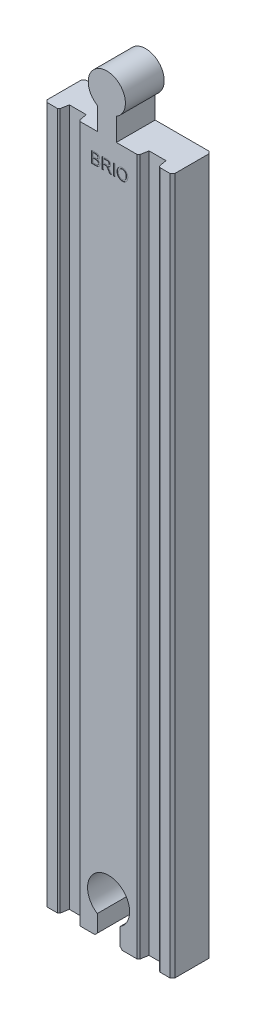
from build123d import *

# Parameters (mm, degrees)
BOSS_EXTRUDE1_DEPTH        = 215.5
BOSS_EXTRUDE2_DEPTH        = 12
BOSS_EXTRUDE2_2_DEPTH      = 12
CHAMFER1_SIZE              = 0.75
BOSS_EXTRUDE4_DEPTH        = 0.1
BOSS_EXTRUDE4_DEPTH_BACK   = 0.1
BOSS_EXTRUDE4_2_DEPTH      = 0.1
BOSS_EXTRUDE4_2_DEPTH_BACK = 0.1
BOSS_EXTRUDE4_3_DEPTH      = 0.1
BOSS_EXTRUDE4_3_DEPTH_BACK = 0.1
SKETCH6_W                  = 0.493589743
SKETCH6_H                  = 3.5
BOSS_EXTRUDE4_4_DEPTH      = 0.1
BOSS_EXTRUDE4_4_DEPTH_BACK = 0.1


with BuildPart() as part:
    # Sketch2 → Boss-Extrude1 (new body)
    with BuildSketch(Plane(origin=(0, 0, 0), x_dir=(1, 0, 0), z_dir=(0, 1, 0))):
        Polygon((0.75, 0), (3.906284454, 0), (4.375743725, 0.393923101), (4.8, 2.8), (10.05, 2.8), (10.474256275, 0.393923101), (10.943715546, 0), (28.556284454, 0), (29.025743725, 0.393923101), (29.45, 2.8), (34.7, 2.8), (35.124256275, 0.393923101), (35.593715546, 0), (38.75, 0), (39.5, 0.75), (39.5, 11.25), (38.75, 12), (0.75, 12), (0, 11.25), (0, 0.75), align=None)
    extrude(amount=BOSS_EXTRUDE1_DEPTH)


with BuildPart() as body_2:
    # Sketch3 → Boss-Extrude2 (new body)
    with BuildSketch(Plane.XY):
        with BuildLine():
            Line((16.25, 215.5), (16.25, 222.5))
            ThreePointArc((16.25, 222.5), (19.2, 233.185585072), (22.15, 222.5))
            Line((22.15, 222.5), (22.15, 215.5))
            Line((22.15, 215.5), (16.25, 215.5))
        make_face()
    extrude(amount=-BOSS_EXTRUDE2_DEPTH)

    # Combine1: union part
    add(part.part)


with BuildPart() as body_3:
    # Sketch3 → Boss-Extrude2 2 (new body)
    with BuildSketch(Plane.XY):
        with BuildLine():
            Line((23.25, 0), (23.25, 6.022774425))
            ThreePointArc((23.25, 6.022774425), (19.75, 18), (16.25, 6.022774425))
            Line((16.25, 6.022774425), (16.25, 0))
            Line((16.25, 0), (16.25, -11.021514521))
            Line((16.25, -11.021514521), (23.25, -11.021514521))
            Line((23.25, -11.021514521), (23.25, 0))
        make_face()
    extrude(amount=-BOSS_EXTRUDE2_2_DEPTH)


with BuildPart() as body_2_1:
    add(body_2.part)

    # Combine2: cut body 3
    add(body_3.part, mode=Mode.SUBTRACT)

    # Chamfer1
    chamfer1_edges = [body_2_1.edges().sort_by_distance(p)[0] for p in [
        (23.25, 0, -6),
        (16.25, 0, -6),
    ]]
    chamfer(chamfer1_edges, length=CHAMFER1_SIZE)


with BuildPart() as body_2_2:
    # Sketch6 → Boss-Extrude4 (new, two sides: drawn at the far end of the back side and taken through both)
    with BuildSketch(Plane.XY.offset(-BOSS_EXTRUDE4_DEPTH_BACK)):
        with BuildLine():
            Line((14.469436437, 206.106414383), (14.469436437, 209.606414383))
            Line((14.469436437, 209.606414383), (15.779833072, 209.606414383))
            add(Edge.make_bspline(
                [(15.779833072, 209.606414383), (15.812328741, 209.606289722), (15.87573703, 209.606046472), (15.968326243, 209.599963054), (16.056015141, 209.5916422), (16.1389925, 209.580916364), (16.216899275, 209.565353394), (16.289662868, 209.546499896), (16.357661938, 209.524752995), (16.440780438, 209.491625421), (16.536565398, 209.440635043), (16.639160189, 209.364549353), (16.728421643, 209.273197732), (16.801870693, 209.168457925), (16.862384788, 209.056576058), (16.905288574, 208.939683587), (16.932719287, 208.820325544), (16.935831622, 208.739504759), (16.937385155, 208.69916278)],
                knots=[0, 0, 0, 0, 0.939712594, 1.833646414, 2.682508961, 3.487467313, 4.25240329, 4.978730417, 5.660668875, 6.315918528, 7.564895217, 8.787077865, 9.996481721, 11.241996224, 12.475862915, 13.665015424, 14.834484263, 16, 16, 16, 16], degree=3))
            add(Edge.make_bspline(
                [(16.937385155, 208.69916278), (16.935752064, 208.661630041), (16.932501627, 208.586926413), (16.906631781, 208.476883425), (16.865801251, 208.37003237), (16.808065726, 208.267672233), (16.734272487, 208.17167567), (16.642789944, 208.08529066), (16.534932691, 208.008332069), (16.453985827, 207.967310877), (16.412244931, 207.946157972)],
                knots=[0, 0, 0, 0, 0.926741525, 1.844548388, 2.778836836, 3.746021974, 4.738420572, 5.759761325, 6.844803049, 8, 8, 8, 8], degree=3))
            add(Edge.make_bspline(
                [(16.412244931, 207.946157972), (16.438066126, 207.938074831), (16.488619633, 207.922249415), (16.561295551, 207.893291124), (16.629516042, 207.860317966), (16.693429604, 207.823275755), (16.75260438, 207.781821464), (16.806873403, 207.735890466), (16.856612948, 207.686193533), (16.901734152, 207.632760894), (16.941368396, 207.5759364), (16.976915362, 207.516962009), (17.0062685, 207.455127541), (17.030328198, 207.390593533), (17.04909834, 207.323758748), (17.062577345, 207.254366128), (17.070260033, 207.182577199), (17.071413949, 207.133809517), (17.07200054, 207.109018549)],
                knots=[0, 0, 0, 0, 1.127427615, 2.20731145, 3.257257018, 4.283066884, 5.282973838, 6.264540225, 7.242620376, 8.210460609, 9.17525685, 10.12748095, 11.077310519, 12.023587065, 12.994999128, 13.967387486, 14.966724908, 16, 16, 16, 16], degree=3))
            add(Edge.make_bspline(
                [(17.07200054, 207.109018549), (17.070791486, 207.069216998), (17.068394996, 206.990325479), (17.049148505, 206.874210431), (17.016622956, 206.762517542), (16.971854303, 206.657052749), (16.918510652, 206.559535021), (16.857883723, 206.47251769), (16.791519629, 206.396896158), (16.717549625, 206.333284932), (16.636450849, 206.279297617), (16.545932729, 206.233836767), (16.446695135, 206.193744654), (16.336721117, 206.161717594), (16.216060736, 206.13627534), (16.08307652, 206.119745465), (15.937564158, 206.107912291), (15.836183921, 206.10692764), (15.783338681, 206.106414383)],
                knots=[0, 0, 0, 0, 1.028073207, 2.037766189, 3.031549473, 4.027532207, 4.992436545, 5.898794514, 6.762903869, 7.584966804, 8.412380356, 9.273953678, 10.198004568, 11.174406109, 12.229717296, 13.381036288, 14.634844708, 16, 16, 16, 16], degree=3))
            Line((15.783338681, 206.106414383), (14.469436437, 206.106414383))
        make_face()
        with BuildLine():
            Line((14.963026181, 208.125645152), (15.684480508, 208.125645152))
            add(Edge.make_bspline(
                [(15.684480508, 208.125645152), (15.708088289, 208.125738553), (15.753444171, 208.125917998), (15.81886895, 208.128419997), (15.879252884, 208.13055456), (15.934362402, 208.135912149), (15.98447052, 208.141159669), (16.02937671, 208.14822365), (16.069300927, 208.156183153), (16.093746532, 208.163566191), (16.105153584, 208.167011338)],
                knots=[0, 0, 0, 0, 1.335841395, 2.566453063, 3.705076039, 4.753984432, 5.69893722, 6.555639608, 7.326018133, 8, 8, 8, 8], degree=3))
            add(Edge.make_bspline(
                [(16.105153584, 208.167011338), (16.131956066, 208.176400249), (16.183625643, 208.194500106), (16.252867708, 208.2356067), (16.311841821, 208.284934412), (16.360389945, 208.343354249), (16.397696772, 208.41055357), (16.425358708, 208.485138827), (16.440504232, 208.568152652), (16.44266853, 208.625719822), (16.443795411, 208.655693229)],
                knots=[0, 0, 0, 0, 1.059015028, 2.041559358, 2.989777133, 3.920090524, 4.862499371, 5.848878527, 6.879979022, 8, 8, 8, 8], degree=3))
            add(Edge.make_bspline(
                [(16.443795411, 208.655693229), (16.442889322, 208.684499612), (16.441123459, 208.740639931), (16.426300617, 208.822165407), (16.400650236, 208.898009892), (16.365912596, 208.968156749), (16.321925515, 209.030562453), (16.269425398, 209.084216751), (16.206533964, 209.124777038), (16.147749312, 209.150078628), (16.094877176, 209.16590716), (16.047637779, 209.175272251), (15.994054214, 209.183523827), (15.93395015, 209.190539043), (15.867302854, 209.195983497), (15.793906972, 209.200308755), (15.713937219, 209.202145155), (15.658539429, 209.202423693), (15.629793008, 209.202568229)],
                knots=[0, 0, 0, 0, 1.216168307, 2.37017178, 3.484610845, 4.588286376, 5.664695412, 6.69777344, 7.738183022, 8.803673002, 9.390844981, 10.0665252, 10.835811589, 11.680682236, 12.621801058, 13.660007223, 14.785756265, 16, 16, 16, 16], degree=3))
            Line((15.629793008, 209.202568229), (14.963026181, 209.202568229))
            Line((14.963026181, 209.202568229), (14.963026181, 208.125645152))
        make_face(mode=Mode.SUBTRACT)
        with BuildLine():
            Line((14.963026181, 206.510260537), (15.79105102, 206.510260537))
            add(Edge.make_bspline(
                [(15.79105102, 206.510260537), (15.824004499, 206.510639125), (15.88454913, 206.511334698), (15.967362358, 206.513516741), (16.034301049, 206.518846657), (16.073389707, 206.524585616), (16.090430027, 206.52708746)],
                knots=[0, 0, 0, 0, 1.317581857, 2.420761387, 3.311546315, 4, 4, 4, 4], degree=3))
            add(Edge.make_bspline(
                [(16.090430027, 206.52708746), (16.114860786, 206.532222558), (16.162165053, 206.542165435), (16.22885272, 206.564356901), (16.289996879, 206.589778407), (16.344530352, 206.622086318), (16.39502704, 206.659318971), (16.43891242, 206.705824338), (16.479332938, 206.758662308), (16.514353758, 206.819129355), (16.542673177, 206.886022018), (16.564317224, 206.958306761), (16.57584642, 207.035730136), (16.577543941, 207.088885488), (16.578410796, 207.116029767)],
                knots=[0, 0, 0, 0, 1.067651492, 2.067249321, 3.003744366, 3.895862395, 4.774133402, 5.679610569, 6.621910665, 7.616993802, 8.661192143, 9.724711987, 10.838102842, 12, 12, 12, 12], degree=3))
            add(Edge.make_bspline(
                [(16.578410796, 207.116029767), (16.577445025, 207.147898777), (16.575561673, 207.2100466), (16.557659769, 207.299853353), (16.528088753, 207.383150233), (16.48646138, 207.458783662), (16.435403233, 207.526809419), (16.373628031, 207.584513817), (16.30159769, 207.630305111), (16.219090832, 207.666242415), (16.122656841, 207.691811187), (16.009633368, 207.70915805), (15.878212567, 207.720351565), (15.784299487, 207.721295856), (15.734260155, 207.721798998)],
                knots=[0, 0, 0, 0, 0.96167883, 1.875371887, 2.752872588, 3.621584364, 4.472914353, 5.312011319, 6.159851575, 7.038572308, 8.019870099, 9.164119506, 10.488969081, 12, 12, 12, 12], degree=3))
            Line((15.734260155, 207.721798998), (14.963026181, 207.721798998))
            Line((14.963026181, 207.721798998), (14.963026181, 206.510260537))
        make_face(mode=Mode.SUBTRACT)
    extrude(amount=BOSS_EXTRUDE4_DEPTH + BOSS_EXTRUDE4_DEPTH_BACK)


with BuildPart() as body_3_2:
    # Sketch6 → Boss-Extrude4 2 (new, two sides: drawn at the far end of the back side and taken through both)
    with BuildSketch(Plane.XY.offset(-BOSS_EXTRUDE4_2_DEPTH_BACK)):
        with BuildLine():
            Line((17.700205668, 206.106414383), (17.700205668, 209.606414383))
            Line((17.700205668, 209.606414383), (19.218835475, 209.606414383))
            add(Edge.make_bspline(
                [(19.218835475, 209.606414383), (19.254594557, 209.606134196), (19.323802075, 209.605591926), (19.424167266, 209.601753274), (19.517848109, 209.593478146), (19.605016854, 209.584529748), (19.685658012, 209.570795154), (19.759688389, 209.555041884), (19.827222283, 209.536295254), (19.888561612, 209.514154039), (19.945471135, 209.489104572), (19.998221963, 209.458197574), (20.049006882, 209.424330093), (20.095941085, 209.384540858), (20.140262467, 209.340975329), (20.18192995, 209.293041542), (20.220326679, 209.24032353), (20.267684446, 209.164873121), (20.318489674, 209.064389066), (20.36081841, 208.935791248), (20.388111221, 208.801273236), (20.39103163, 208.709345759), (20.39251336, 208.662704447)],
                knots=[0, 0, 0, 0, 1.242255013, 2.404239178, 3.487702428, 4.508875116, 5.447164253, 6.327763259, 7.137389581, 7.87956647, 8.591787438, 9.293660819, 10.000726923, 10.709654955, 11.427269343, 12.158170644, 12.913245971, 13.690346794, 15.251572448, 16.809945773, 18.381459854, 20, 20, 20, 20], degree=3))
            add(Edge.make_bspline(
                [(20.39251336, 208.662704447), (20.391828471, 208.632764884), (20.390475768, 208.573632195), (20.380113926, 208.486691314), (20.361365009, 208.403622799), (20.33732322, 208.323699149), (20.304417344, 208.248052756), (20.266297315, 208.175138519), (20.219072018, 208.106959586), (20.166198077, 208.041700462), (20.105565845, 207.980758823), (20.036641943, 207.926333293), (19.960109596, 207.877377421), (19.875608368, 207.835241916), (19.784110954, 207.796728065), (19.684469312, 207.765714856), (19.577085587, 207.740390193), (19.502642198, 207.728127014), (19.464228104, 207.721798998)],
                knots=[0, 0, 0, 0, 0.982609109, 1.940720374, 2.867584677, 3.775009516, 4.675469332, 5.571146231, 6.471115823, 7.392408543, 8.32534739, 9.286126426, 10.269214477, 11.301811357, 12.381622301, 13.524260118, 14.722474812, 16, 16, 16, 16], degree=3))
            add(Edge.make_bspline(
                [(19.464228104, 207.721798998), (19.492406297, 207.707563996), (19.545917701, 207.680531216), (19.620004902, 207.63814405), (19.682806059, 207.594834812), (19.719189951, 207.563858772), (19.73626336, 207.549323037)],
                knots=[0, 0, 0, 0, 1.172304973, 2.226249348, 3.167654437, 4, 4, 4, 4], degree=3))
            add(Edge.make_bspline(
                [(19.73626336, 207.549323037), (19.769326982, 207.516911025), (19.837242011, 207.45033445), (19.93083187, 207.33693504), (20.021570453, 207.210704096), (20.076700983, 207.119476564), (20.105053424, 207.072560216)],
                knots=[0, 0, 0, 0, 0.918110279, 1.885863737, 2.912745394, 4, 4, 4, 4], degree=3))
            Line((20.105053424, 207.072560216), (20.679272174, 206.106414383))
            Line((20.679272174, 206.106414383), (20.113466886, 206.106414383))
            Line((20.113466886, 206.106414383), (19.677369129, 206.845396755))
            add(Edge.make_bspline(
                [(19.677369129, 206.845396755), (19.661689244, 206.871324839), (19.631304202, 206.92156921), (19.587414097, 206.994948695), (19.544381293, 207.062506203), (19.504469102, 207.126172564), (19.466057823, 207.184791946), (19.429518597, 207.238567983), (19.395857001, 207.288206145), (19.354162762, 207.345997883), (19.305637592, 207.409944978), (19.249012049, 207.47579841), (19.195087743, 207.528302474), (19.128678965, 207.579788294), (19.046421647, 207.627944624), (18.976501374, 207.650071135), (18.942593488, 207.660801402)],
                knots=[0, 0, 0, 0, 1.130940588, 2.191577161, 3.191089816, 4.120344442, 4.99615009, 5.80661983, 6.546979556, 7.234477901, 8.466216387, 9.541989141, 10.473533583, 11.269175393, 12.675684693, 14, 14, 14, 14], degree=3))
            add(Edge.make_bspline(
                [(18.942593488, 207.660801402), (18.928366996, 207.663366922), (18.895887488, 207.669224081), (18.840737365, 207.673049401), (18.773916225, 207.677109466), (18.725489806, 207.67699117), (18.699304225, 207.676927203)],
                knots=[0, 0, 0, 0, 0.709978628, 1.620902492, 2.713552433, 4, 4, 4, 4], degree=3))
            Line((18.699304225, 207.676927203), (18.193795411, 207.676927203))
            Line((18.193795411, 207.676927203), (18.193795411, 206.106414383))
            Line((18.193795411, 206.106414383), (17.700205668, 206.106414383))
        make_face()
        with BuildLine():
            Line((18.193795411, 208.080773357), (19.131195251, 208.080773357))
            add(Edge.make_bspline(
                [(19.131195251, 208.080773357), (19.17820003, 208.081508791), (19.266071055, 208.082883617), (19.388944782, 208.094623182), (19.493660537, 208.113277849), (19.582288401, 208.140487866), (19.656749797, 208.178264405), (19.721510287, 208.224302177), (19.77532707, 208.281969279), (19.820097073, 208.347034327), (19.854897716, 208.418635163), (19.880001239, 208.493841344), (19.896431932, 208.572020811), (19.898085699, 208.625228673), (19.898923616, 208.65218762)],
                knots=[0, 0, 0, 0, 1.546323217, 2.890706218, 4.056530419, 5.041445823, 5.928701482, 6.793137403, 7.641659452, 8.509781392, 9.383301667, 10.251423607, 11.114044887, 12, 12, 12, 12], degree=3))
            add(Edge.make_bspline(
                [(19.898923616, 208.65218762), (19.898272171, 208.67183363), (19.896996179, 208.710314391), (19.890307011, 208.766793465), (19.87730168, 208.820461641), (19.860128173, 208.871602613), (19.837180882, 208.919841811), (19.809920436, 208.965553035), (19.777390309, 209.008482936), (19.74012892, 209.048762284), (19.697346074, 209.085412554), (19.648478006, 209.117033788), (19.593910136, 209.143905015), (19.533579036, 209.165231817), (19.467674762, 209.182289788), (19.395822134, 209.193637905), (19.318349751, 209.201849365), (19.264665882, 209.202324131), (19.237064642, 209.202568229)],
                knots=[0, 0, 0, 0, 0.965208469, 1.890559848, 2.786986821, 3.67262109, 4.535197034, 5.405224191, 6.282113641, 7.175449223, 8.095446547, 9.040936516, 10.026471658, 11.075712529, 12.17809725, 13.364958037, 14.645208957, 16, 16, 16, 16], degree=3))
            Line((19.237064642, 209.202568229), (18.193795411, 209.202568229))
            Line((18.193795411, 209.202568229), (18.193795411, 208.080773357))
        make_face(mode=Mode.SUBTRACT)
    extrude(amount=BOSS_EXTRUDE4_2_DEPTH + BOSS_EXTRUDE4_2_DEPTH_BACK)


with BuildPart() as body_4:
    # Sketch6 → Boss-Extrude4 3 (new, two sides: drawn at the far end of the back side and taken through both)
    with BuildSketch(Plane.XY.offset(-BOSS_EXTRUDE4_3_DEPTH_BACK)):
        with Locations((21.491872335, 207.856414383)):
            Rectangle(SKETCH6_W, SKETCH6_H)
    extrude(amount=BOSS_EXTRUDE4_3_DEPTH + BOSS_EXTRUDE4_3_DEPTH_BACK)


with BuildPart() as body_5:
    # Sketch6 → Boss-Extrude4 4 (new, two sides: drawn at the far end of the back side and taken through both)
    with BuildSketch(Plane.XY.offset(-BOSS_EXTRUDE4_4_DEPTH_BACK)):
        with BuildLine():
            add(Edge.make_bspline(
                [(22.366872334, 207.810140344), (22.3680888, 207.880312328), (22.370459021, 208.017038878), (22.392605273, 208.216130354), (22.428565101, 208.40344939), (22.479972859, 208.578981393), (22.545132338, 208.743001422), (22.624346134, 208.895880876), (22.719996943, 209.03588927), (22.828202382, 209.164359393), (22.949062888, 209.277936397), (23.077744975, 209.37880905), (23.215855479, 209.462948767), (23.362118364, 209.532420436), (23.517155039, 209.585758771), (23.680530207, 209.623100459), (23.852069141, 209.647189476), (23.969320017, 209.649900776), (24.02923211, 209.651286178)],
                knots=[0, 0, 0, 0, 1.203621547, 2.345195544, 3.432004029, 4.472479546, 5.478447225, 6.455936844, 7.420185704, 8.381829745, 9.332027588, 10.260832629, 11.182364398, 12.100723901, 13.034044877, 13.989196293, 14.972532542, 16, 16, 16, 16], degree=3))
            add(Edge.make_bspline(
                [(24.02923211, 209.651286178), (24.068748253, 209.650596151), (24.147220164, 209.649225884), (24.263233882, 209.63879998), (24.376266455, 209.620191547), (24.486206575, 209.59525416), (24.593353499, 209.562537393), (24.697771214, 209.523916245), (24.798545659, 209.476059205), (24.89634726, 209.422478486), (24.99002154, 209.362546135), (25.078056395, 209.296338988), (25.160240952, 209.224357768), (25.237679173, 209.147785648), (25.307787053, 209.064038428), (25.373460928, 208.975667191), (25.43281362, 208.881104972), (25.486055725, 208.781126547), (25.533659577, 208.677276066), (25.574346262, 208.56912311), (25.609283175, 208.457965051), (25.638528319, 208.34314395), (25.659512499, 208.224699062), (25.676222429, 208.103140754), (25.685017326, 207.978071732), (25.686589221, 207.893585379), (25.687385155, 207.850805408)],
                knots=[0, 0, 0, 0, 1.034375294, 2.054082248, 3.045783978, 4.031219655, 5.002789406, 5.976610191, 6.94273282, 7.920236376, 8.894345378, 9.851183672, 10.800797181, 11.752517031, 12.698794154, 13.65688337, 14.632873302, 15.61821402, 16.620222298, 17.621258913, 18.640965868, 19.669244166, 20.720417492, 21.788124603, 22.880008887, 24, 24, 24, 24], degree=3))
            add(Edge.make_bspline(
                [(25.687385155, 207.850805408), (25.686655906, 207.807319995), (25.685215148, 207.721407063), (25.675466394, 207.594487377), (25.658324694, 207.471211291), (25.635589149, 207.35121122), (25.605124212, 207.234736977), (25.568921315, 207.121454626), (25.525131867, 207.012038896), (25.475676547, 206.906226075), (25.419717874, 206.805471456), (25.35799166, 206.710479562), (25.290454176, 206.622138967), (25.21813131, 206.539365959), (25.13933413, 206.463640672), (25.055032916, 206.394255021), (24.965551806, 206.33055462), (24.870590189, 206.274264674), (24.771852281, 206.224924526), (24.671291948, 206.181150925), (24.568834493, 206.143819056), (24.464129748, 206.113565287), (24.357463336, 206.090703362), (24.24913543, 206.073584111), (24.138790916, 206.063726788), (24.064540732, 206.062274396), (24.027128745, 206.061542588)],
                knots=[0, 0, 0, 0, 1.141429366, 2.255090526, 3.338676798, 4.407031443, 5.458968682, 6.496860253, 7.526652771, 8.550250826, 9.560787671, 10.54935636, 11.521089193, 12.477323897, 13.431786008, 14.386110112, 15.340986122, 16.312041, 17.28047646, 18.236612773, 19.189437236, 20.140779471, 21.09494583, 22.051062463, 23.018000708, 24, 24, 24, 24], degree=3))
            add(Edge.make_bspline(
                [(24.027128745, 206.061542588), (23.986902549, 206.062137739), (23.907224528, 206.063316586), (23.789458268, 206.07508348), (23.674621847, 206.093034287), (23.563049116, 206.11894983), (23.454892534, 206.152758486), (23.350024127, 206.193679414), (23.248075062, 206.241165718), (23.150310358, 206.296577086), (23.057062765, 206.358188571), (22.969236075, 206.425693905), (22.886878851, 206.498470967), (22.811312589, 206.577722674), (22.740089937, 206.660576121), (22.676058696, 206.75011092), (22.617127706, 206.844296515), (22.565040831, 206.944040814), (22.517988134, 207.046379795), (22.478345221, 207.151346194), (22.443506783, 207.257393084), (22.415761494, 207.365174095), (22.393651875, 207.474440601), (22.378784758, 207.585010784), (22.368047613, 207.697049322), (22.367266065, 207.772253633), (22.366872334, 207.810140344)],
                knots=[0, 0, 0, 0, 1.072727997, 2.12480551, 3.153819198, 4.171534612, 5.177148798, 6.173931848, 7.17235114, 8.174500385, 9.168706755, 10.151274001, 11.127173509, 12.097141049, 13.070188938, 14.039134204, 15.03036519, 16.031505612, 17.038625933, 18.033164522, 19.022845559, 20.014762458, 21.000193215, 21.994692725, 22.989758729, 24, 24, 24, 24], degree=3))
        make_face()
        with BuildLine():
            add(Edge.make_bspline(
                [(22.860462078, 207.80453137), (22.861218481, 207.754001211), (22.862693413, 207.655470966), (22.879567437, 207.511819109), (22.905171072, 207.376276266), (22.940462981, 207.248461937), (22.987903948, 207.129640185), (23.044625768, 207.018669249), (23.112538276, 206.916286802), (23.190143121, 206.822779246), (23.275499554, 206.738779064), (23.366711564, 206.665409374), (23.463799657, 206.603967449), (23.565687437, 206.553234023), (23.673106718, 206.513631958), (23.785735777, 206.485824385), (23.903657368, 206.468433006), (23.98406535, 206.466416139), (24.025025379, 206.465388742)],
                knots=[0, 0, 0, 0, 1.215430442, 2.370003584, 3.475209778, 4.53279855, 5.55522989, 6.548792651, 7.526809858, 8.505409025, 9.467826767, 10.404123909, 11.316848639, 12.227335424, 13.138360512, 14.065900994, 15.014765094, 16, 16, 16, 16], degree=3))
            add(Edge.make_bspline(
                [(24.025025379, 206.465388742), (24.066679683, 206.466431335), (24.148238691, 206.468472729), (24.26793811, 206.48556051), (24.381665957, 206.514651728), (24.490549479, 206.55337873), (24.592620167, 206.605731035), (24.690265163, 206.667035297), (24.780822652, 206.741947349), (24.866515563, 206.826096093), (24.943376332, 206.921746597), (25.011574083, 207.026542682), (25.066973137, 207.142056024), (25.114802742, 207.265742022), (25.149826336, 207.399938388), (25.175710917, 207.54311958), (25.191309515, 207.695746167), (25.192952127, 207.800521487), (25.193795411, 207.854311017)],
                knots=[0, 0, 0, 0, 0.976878588, 1.912725521, 2.8289017, 3.727303729, 4.617335839, 5.514666588, 6.426584173, 7.368641557, 8.327632997, 9.299405846, 10.294892156, 11.327373912, 12.405931897, 13.542618837, 14.738430195, 16, 16, 16, 16], degree=3))
            add(Edge.make_bspline(
                [(25.193795411, 207.854311017), (25.193497395, 207.8889157), (25.192912795, 207.956797565), (25.18517073, 208.056856211), (25.17518446, 208.15380246), (25.159980208, 208.247511217), (25.13902682, 208.337594413), (25.115814025, 208.424737852), (25.086787236, 208.508190581), (25.053852298, 208.588279869), (25.016998661, 208.664594553), (24.97543266, 208.73649127), (24.929637376, 208.803690501), (24.880848421, 208.867466276), (24.826364137, 208.925350211), (24.768807976, 208.979787351), (24.706872551, 209.029653011), (24.641175955, 209.074960219), (24.57265018, 209.115743846), (24.50143649, 209.150649339), (24.428669421, 209.181309429), (24.353130956, 209.204811675), (24.275864134, 209.223766581), (24.196556604, 209.238164598), (24.114913994, 209.245620561), (24.059860781, 209.246829181), (24.032036597, 209.247440024)],
                knots=[0, 0, 0, 0, 1.220438779, 2.394059227, 3.538503547, 4.658058814, 5.74010225, 6.800155734, 7.837851593, 8.854470756, 9.853724944, 10.825214244, 11.781044712, 12.72106398, 13.654479919, 14.581868691, 15.514082315, 16.456304431, 17.39516604, 18.324312202, 19.252140633, 20.177768678, 21.111585046, 22.057694709, 23.018348693, 24, 24, 24, 24], degree=3))
            add(Edge.make_bspline(
                [(24.032036597, 209.247440024), (23.992710909, 209.246659031), (23.915116945, 209.245118046), (23.800889392, 209.227987599), (23.690761647, 209.202392371), (23.584562801, 209.166608879), (23.483201158, 209.119225911), (23.386151572, 209.061117186), (23.292552586, 208.993864913), (23.203880121, 208.915830504), (23.121217989, 208.826188017), (23.051335449, 208.720502272), (22.992436535, 208.601296209), (22.943257027, 208.468871989), (22.9057591, 208.322204073), (22.879843343, 208.161923641), (22.863480662, 207.987861799), (22.861493996, 207.867203795), (22.860462078, 207.80453137)],
                knots=[0, 0, 0, 0, 0.895090134, 1.766112571, 2.624765742, 3.468151641, 4.313618154, 5.168136083, 6.041303099, 6.935189387, 7.854749729, 8.809996334, 9.809869957, 10.877771942, 12.021723904, 13.25217762, 14.572720513, 16, 16, 16, 16], degree=3))
        make_face(mode=Mode.SUBTRACT)
    extrude(amount=BOSS_EXTRUDE4_4_DEPTH + BOSS_EXTRUDE4_4_DEPTH_BACK)


with BuildPart() as body_2_3:
    add(body_2_1.part)

    # Combine4: cut body 2 2, body 3 2, body 4, body 5
    add(body_2_2.part, mode=Mode.SUBTRACT)
    add(body_3_2.part, mode=Mode.SUBTRACT)
    add(body_4.part, mode=Mode.SUBTRACT)
    add(body_5.part, mode=Mode.SUBTRACT)


solid = body_2_3.part
